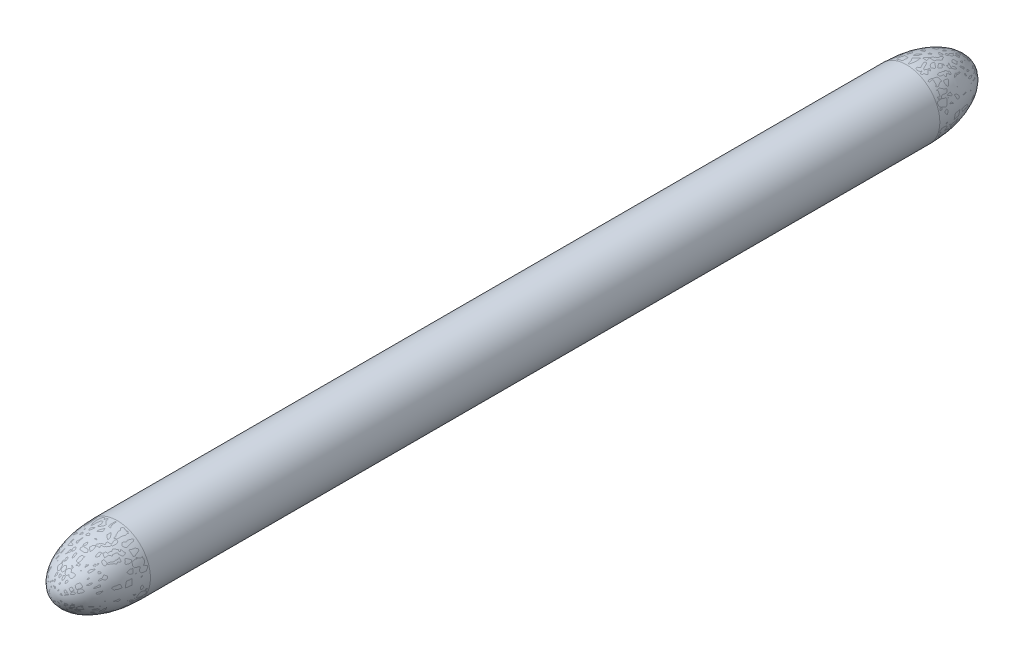
from build123d import *

# Parameters (mm, degrees)
ESBO_O1_R                = 1050
RESSALTO_EXTRUS_O1_DEPTH = 25000
DOMO2_FACE_RADIUS        = 1050
DOMO2_HEIGHT             = 2000
DOMO3_FACE_RADIUS        = 1050
DOMO3_HEIGHT             = 2000
CASCA1_T                 = 3


with BuildPart() as part:
    # Esboço1 → Ressalto-extrusão1 (new body)
    with BuildSketch(Plane.XY):
        Circle(ESBO_O1_R)
    extrude(amount=RESSALTO_EXTRUS_O1_DEPTH)

    # Domo2: an elliptical dome of height H over a round flat face of radius A is half a spheroid: the quarter ellipse of half axes A and H revolved about the face's axis
    with BuildSketch(Plane((0, 0, 25000), x_dir=(0, 1, 0), z_dir=(1, 0, 0)), mode=Mode.PRIVATE) as domo2_quarter:
        Ellipse(DOMO2_FACE_RADIUS, DOMO2_HEIGHT)
        Rectangle(DOMO2_FACE_RADIUS, DOMO2_HEIGHT, align=(Align.MIN, Align.MIN), mode=Mode.INTERSECT)
    revolve(domo2_quarter.sketch, axis=Axis((0, 0, 25000), (0, 0, 1)))

    # Domo3: an elliptical dome of height H over a round flat face of radius A is half a spheroid: the quarter ellipse of half axes A and H revolved about the face's axis
    with BuildSketch(Plane((0, 0, 0), x_dir=(0, -1, 0), z_dir=(1, 0, 0)), mode=Mode.PRIVATE) as domo3_quarter:
        Ellipse(DOMO3_FACE_RADIUS, DOMO3_HEIGHT)
        Rectangle(DOMO3_FACE_RADIUS, DOMO3_HEIGHT, align=(Align.MIN, Align.MIN), mode=Mode.INTERSECT)
    revolve(domo3_quarter.sketch, axis=Axis((0, 0, 0), (0, 0, -1)))

    # Casca1 (no face opened: a closed hollow body)
    add(offset(amount=-CASCA1_T, mode=Mode.PRIVATE), mode=Mode.SUBTRACT)


solid = part.part
